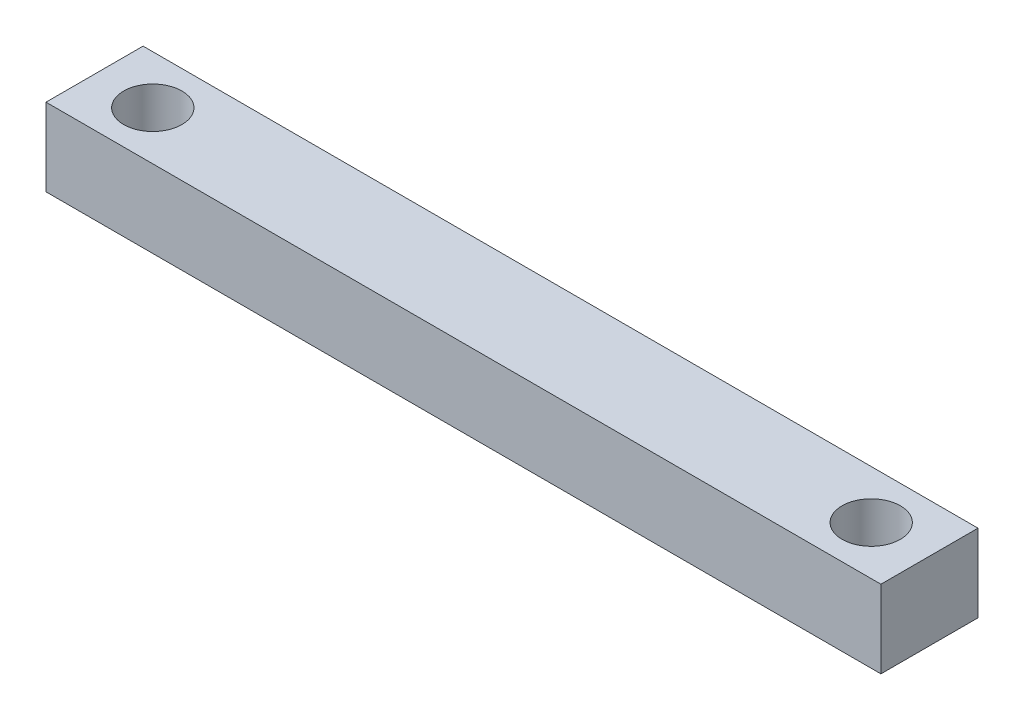
from build123d import *

# Parameters (mm, degrees)
SKETCH_1_W          = 43
SKETCH_1_H          = 5
EXTRUDE_1_DEPTH     = 4
SKETCH_2_R          = 1.5
CUT_EXTRUDE_1_DEPTH = 4


with BuildPart() as part:
    # Эскиз1 → Бобышка-Вытянуть1 (new body)
    with BuildSketch(Plane(origin=(0, 0, 0), x_dir=(1, 0, 0), z_dir=(0, 1, 0))):
        with Locations((-48.719000759, 5.663018052)):
            Rectangle(SKETCH_1_W, SKETCH_1_H)
    extrude(amount=EXTRUDE_1_DEPTH)

    # Эскиз2 → Вырез-Вытянуть1 (cut)
    with BuildSketch(Plane(origin=(0, 4, 0), x_dir=(-1, 0, 0), z_dir=(0, 1, 0))):
        with Locations(Location((67.219000759, -5.663018052, 0), (0, 0, 90))):
            Circle(SKETCH_2_R)
        with Locations(Location((30.219000759, -5.663018052, 0), (0, 0, 90))):
            Circle(SKETCH_2_R)
    extrude(amount=-CUT_EXTRUDE_1_DEPTH, mode=Mode.SUBTRACT)


solid = part.part
